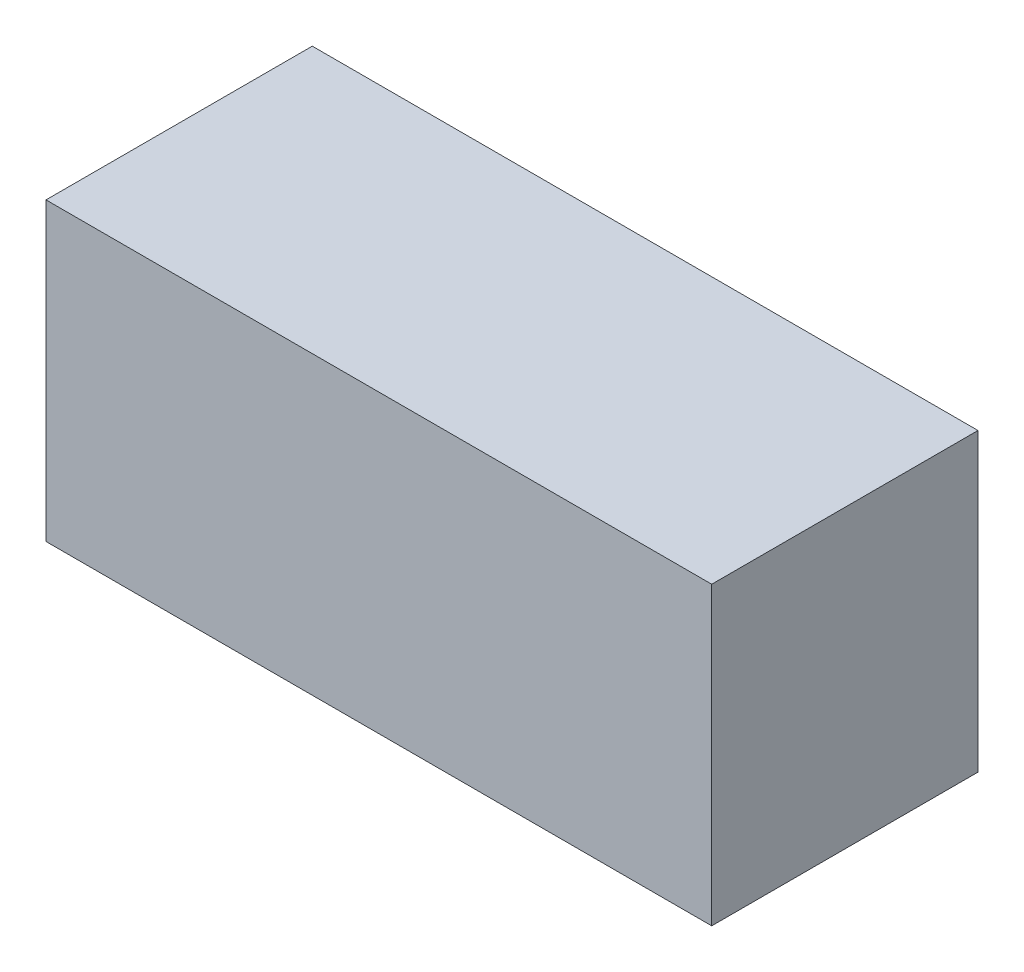
from build123d import *

# Parameters (mm, degrees)
SKETCH_1_W      = 450
SKETCH_1_H      = 200
EXTRUDE_1_DEPTH = 180


with BuildPart() as part:
    # 草图1 → 凸台-拉伸1 (new body)
    with BuildSketch(Plane.XY):
        Rectangle(SKETCH_1_W, SKETCH_1_H)
    extrude(amount=EXTRUDE_1_DEPTH)


solid = part.part
